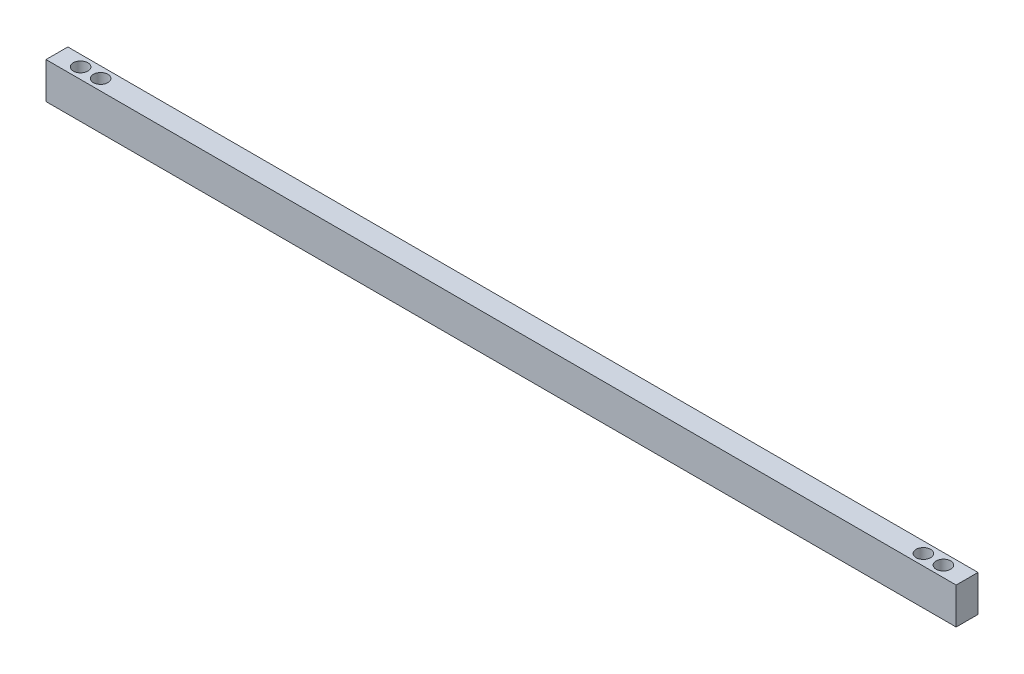
from build123d import *

# Parameters (mm, degrees)
SKETCH1_W           = 635
SKETCH1_H           = 15.24
BOSS_EXTRUDE1_DEPTH = 25.4
SKETCH2_R           = 5.08
CUT_EXTRUDE1_DEPTH  = 27.94


with BuildPart() as part:
    # Sketch1 → Boss-Extrude1 (new body)
    with BuildSketch(Plane(origin=(0, 0, 0), x_dir=(1, 0, 0), z_dir=(0, 1, 0))):
        Rectangle(SKETCH1_W, SKETCH1_H)
    extrude(amount=BOSS_EXTRUDE1_DEPTH)

    # Sketch2 → Cut-Extrude1 (cut)
    with BuildSketch(Plane(origin=(0, 25.4, 0), x_dir=(1, 0, 0), z_dir=(0, 1, 0))):
        with Locations(Location((-300.99, 0, 0), (0, 0, 270))):
            Circle(SKETCH2_R)
        with Locations(Location((-287.02, 0, 0), (0, 0, 270))):
            Circle(SKETCH2_R)
        with Locations(Location((300.99, 0, 0), (0, 0, 270))):
            Circle(SKETCH2_R)
        with Locations(Location((287.02, 0, 0), (0, 0, 270))):
            Circle(SKETCH2_R)
    extrude(amount=-CUT_EXTRUDE1_DEPTH, mode=Mode.SUBTRACT)


solid = part.part
